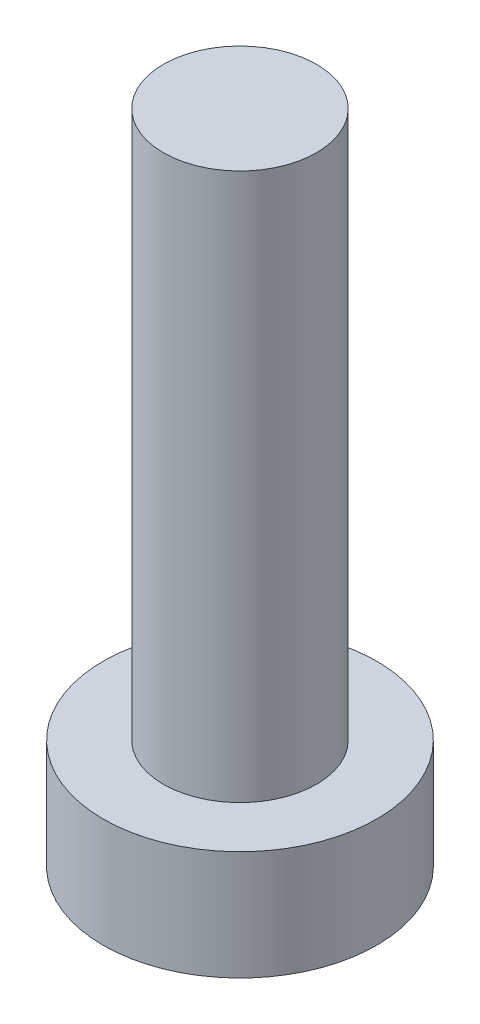
from build123d import *


with BuildPart() as part:
    # Sketch1 → Revolve1 (revolve)
    with BuildSketch(Plane(origin=(0, 0, 0), x_dir=(0, 0, -1), z_dir=(1, 0, 0)), mode=Mode.PRIVATE) as revolve1_sk:
        Polygon((0, 58.709677419), (7, 58.709677419), (7, 8.709677419), (12.5, 8.709677419), (12.5, -1.290322581), (0, -1.290322581), align=None)
    revolve(revolve1_sk.sketch.rotate(Axis((0, 94.838709677, 0), (0, -1, 0)), 180), axis=Axis((0, 94.838709677, 0), (0, -1, 0)))


solid = part.part
